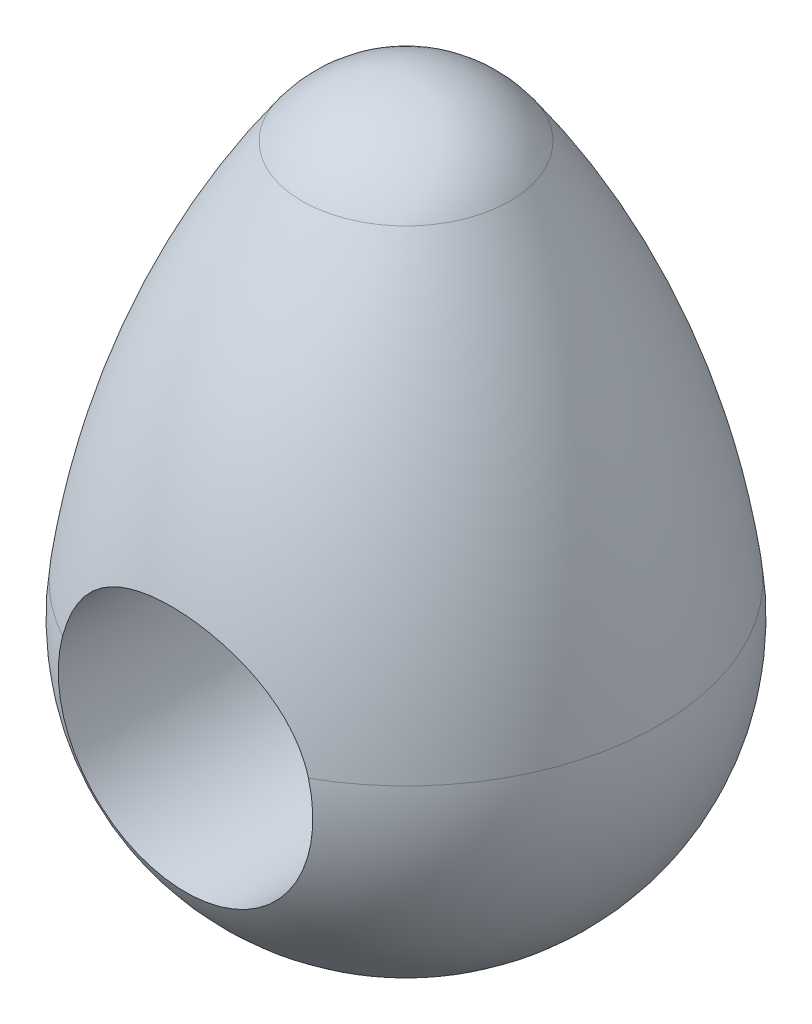
from build123d import *

# Parameters (mm, degrees)
CUT_EXTRUDE1_DEPTH      = 89.217019333
CUT_EXTRUDE1_DEPTH_BACK = 89.217019333
SKETCH3_R               = 19.05


with BuildPart() as part:
    # Sketch2 → Revolve1 (revolve)
    with BuildSketch(Plane.XY, mode=Mode.PRIVATE) as revolve1_sk:
        with BuildLine():
            ThreePointArc((15.556204448, 61.795772059), (8.758796786, 67.717032212), (0, 69.85))
            Line((0, 69.85), (0, -38.1))
            ThreePointArc((0, -38.1), (28.631640293, -25.136411321), (37.77935366, 4.932589286))
            ThreePointArc((37.77935366, 4.932589286), (30.1355237, 34.719437324), (15.556204448, 61.795772059))
        make_face()
    revolve(revolve1_sk.sketch.rotate(Axis((0, 50.8, 0), (0, -1, 0)), 180), axis=Axis((0, 50.8, 0), (0, -1, 0)))

    # Sketch3 → Cut-Extrude1 (cut, two sides: drawn at the far end of the back side and taken through both)
    with BuildSketch(Plane.XY.offset(-CUT_EXTRUDE1_DEPTH_BACK)):
        with Locations(Location((0, 0, 0), (0, 0, 164.993503133))):
            Circle(SKETCH3_R)
    extrude(amount=CUT_EXTRUDE1_DEPTH + CUT_EXTRUDE1_DEPTH_BACK, mode=Mode.SUBTRACT)


solid = part.part
